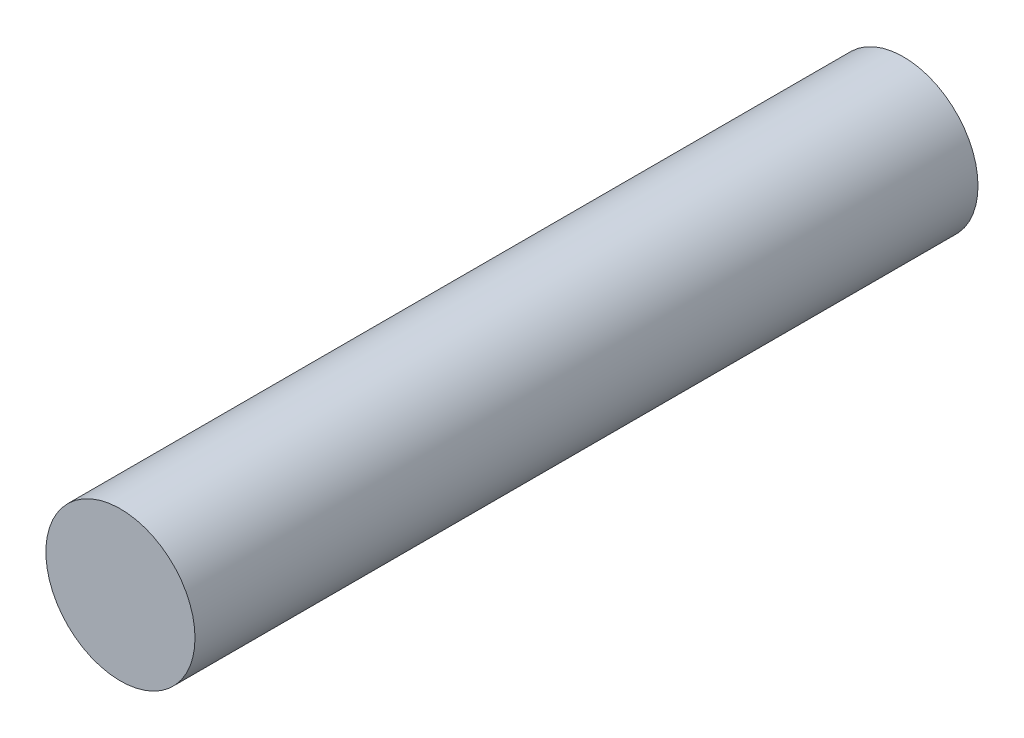
from build123d import *

# Parameters (mm, degrees)
SKETCH_1_R      = 10
EXTRUDE_1_DEPTH = 105


with BuildPart() as part:
    # Эскиз1 → Бобышка-Вытянуть1 (new body)
    with BuildSketch(Plane.XY):
        Circle(SKETCH_1_R)
    extrude(amount=EXTRUDE_1_DEPTH)


solid = part.part
